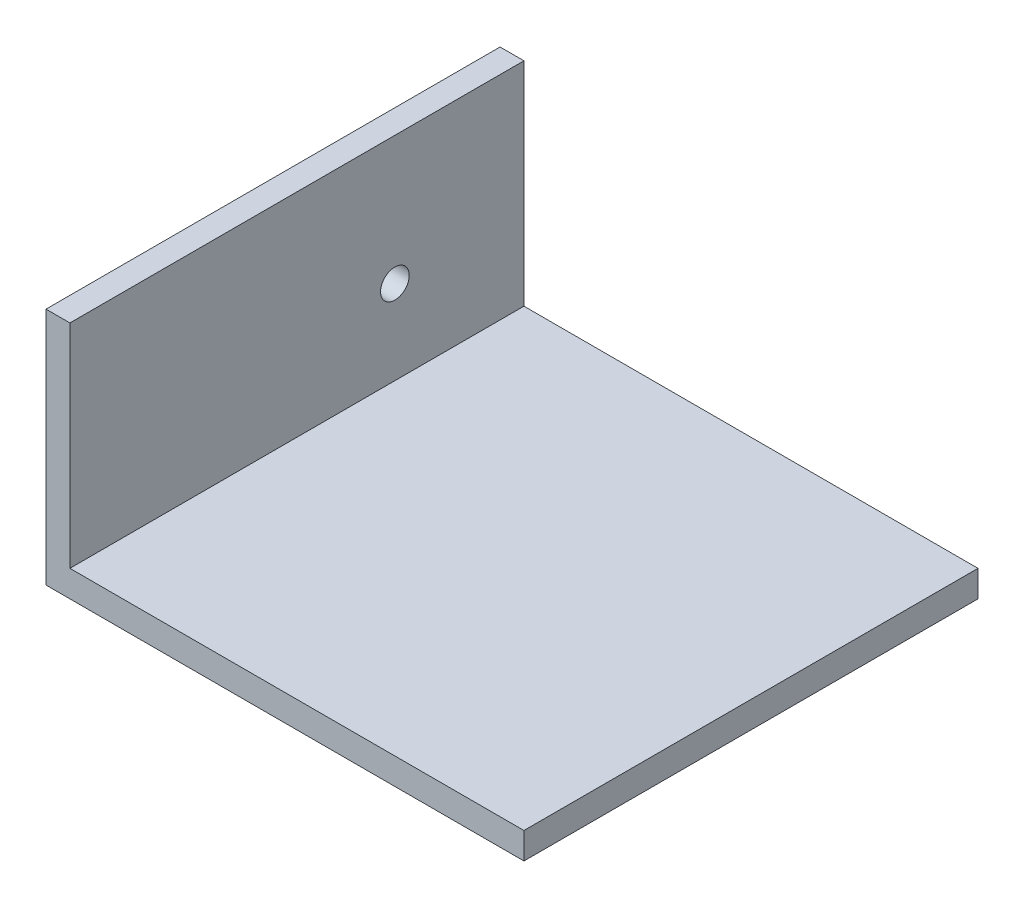
from build123d import *

# Parameters (mm, degrees)
EXTRUDE_1_DEPTH     = 95
CUT_EXTRUDE_1_REACH = 144.466
SKETCH_2_R          = 3


with BuildPart() as part:
    # 草图1 → 凸台-拉伸1 (new body)
    with BuildSketch(Plane.XY):
        Polygon((-43.550332336, 35.659057411), (-38.550332336, 35.659057411), (-38.550332336, -8.806832193), (56.449667664, -8.806832193), (56.449667664, -14.340942589), (-43.550332336, -14.340942589), align=None)
    extrude(amount=EXTRUDE_1_DEPTH)

    # 草图2 → 切除-拉伸1 (cut, up to next)
    with BuildSketch(Plane.ZY.offset(43.550332336), mode=Mode.PRIVATE) as cut_extrude_1_sk1:
        with Locations((27, 8.8)):
            Circle(SKETCH_2_R)
    cut_extrude_1_tool1 = extrude(cut_extrude_1_sk1.sketch, amount=-CUT_EXTRUDE_1_REACH, mode=Mode.PRIVATE) & part.part
    add(cut_extrude_1_tool1.solids().sort_by_distance((-43.550332, 8.8, 27))[0], mode=Mode.SUBTRACT)


solid = part.part
